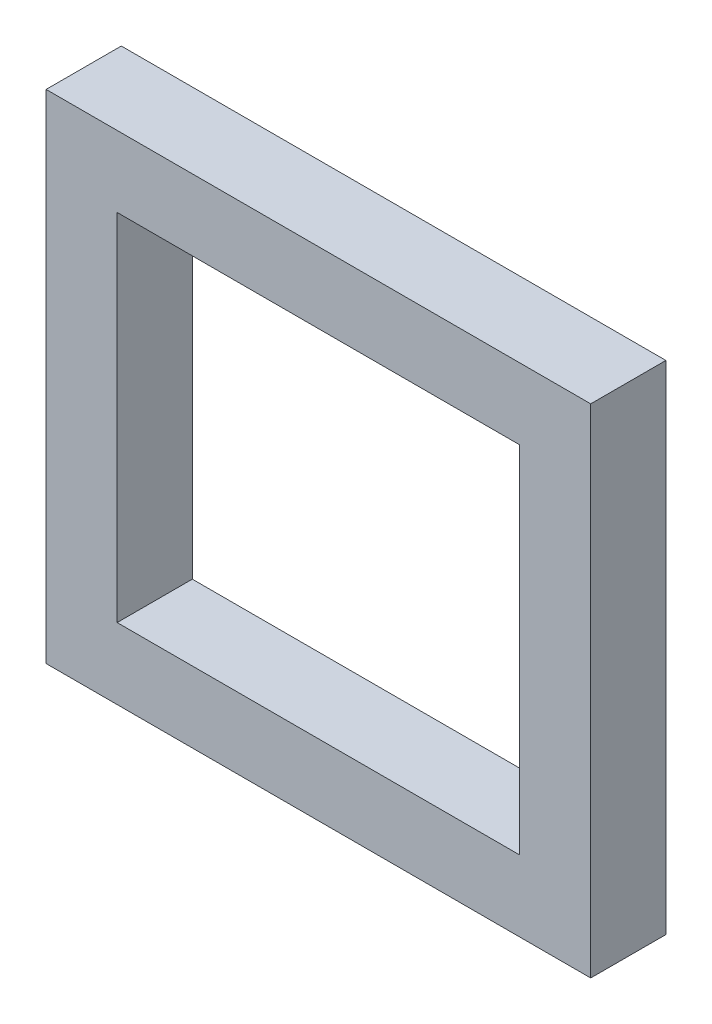
from build123d import *

# Parameters (mm, degrees)
SKETCH1_W           = 23
SKETCH1_H           = 21
SKETCH1_W_2         = 17
SKETCH1_H_2         = 15
BOSS_EXTRUDE1_DEPTH = 3.175


with BuildPart() as part:
    # Sketch1 → Boss-Extrude1 (new body)
    with BuildSketch(Plane.XY):
        Rectangle(SKETCH1_W, SKETCH1_H)
        Rectangle(SKETCH1_W_2, SKETCH1_H_2, mode=Mode.SUBTRACT)
    extrude(amount=BOSS_EXTRUDE1_DEPTH)


solid = part.part
